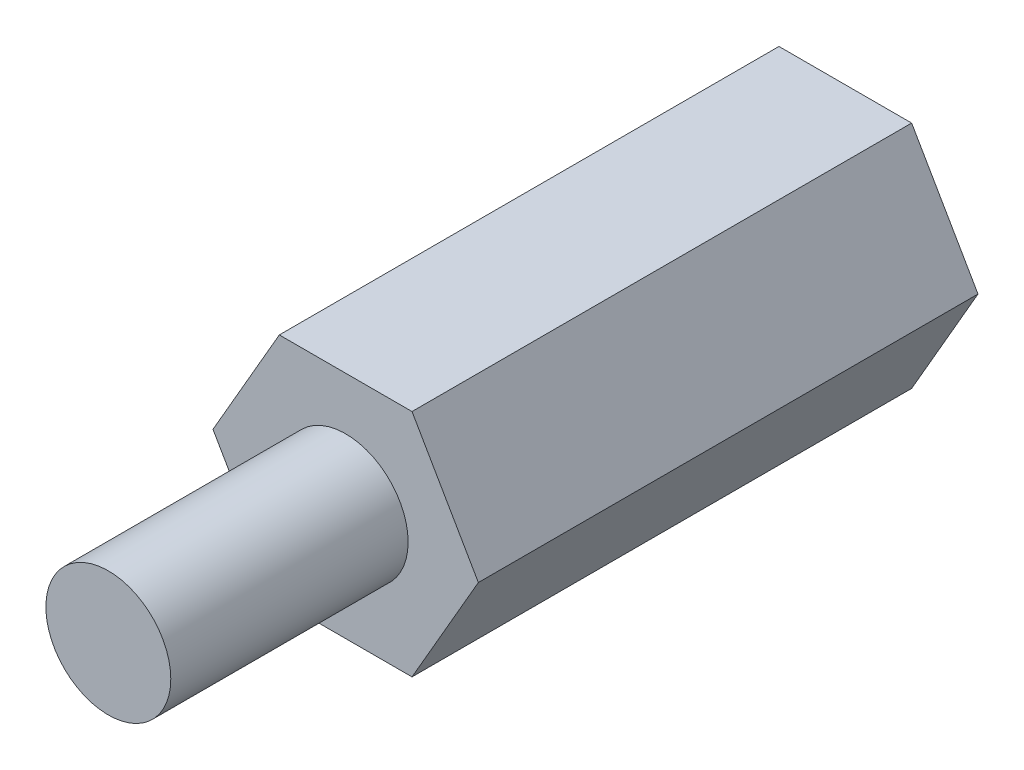
from build123d import *

# Parameters (mm, degrees)
BODY_DEPTH                      = 10
SKIZZE2_R                       = 1.25
THREAD_DEPTH                    = 4.75
SKIZZE3_R                       = 1.25
SCHNITT_LINEAR_AUSTRAGEN1_DEPTH = 6.4


with BuildPart() as part:
    # Skizze1 → Body (new body)
    with BuildSketch(Plane.XY):
        Polygon((2.655811238, 0), (1.327905619, 2.3), (-1.327905619, 2.3), (-2.655811238, 0), (-1.327905619, -2.3), (1.327905619, -2.3), align=None)
    extrude(amount=BODY_DEPTH)

    # Skizze2 → Thread (add)
    with BuildSketch(Plane.XY.offset(10)):
        Circle(SKIZZE2_R)
    extrude(amount=THREAD_DEPTH)

    # Skizze3 → Schnitt-Linear austragen1 (cut)
    with BuildSketch(Plane(origin=(0, 0, 0), x_dir=(-1, 0, 0), z_dir=(0, 0, -1))):
        with Locations(Location((0, 0, 0), (0, 0, 180))):
            Circle(SKIZZE3_R)
    extrude(amount=-SCHNITT_LINEAR_AUSTRAGEN1_DEPTH, mode=Mode.SUBTRACT)


solid = part.part
